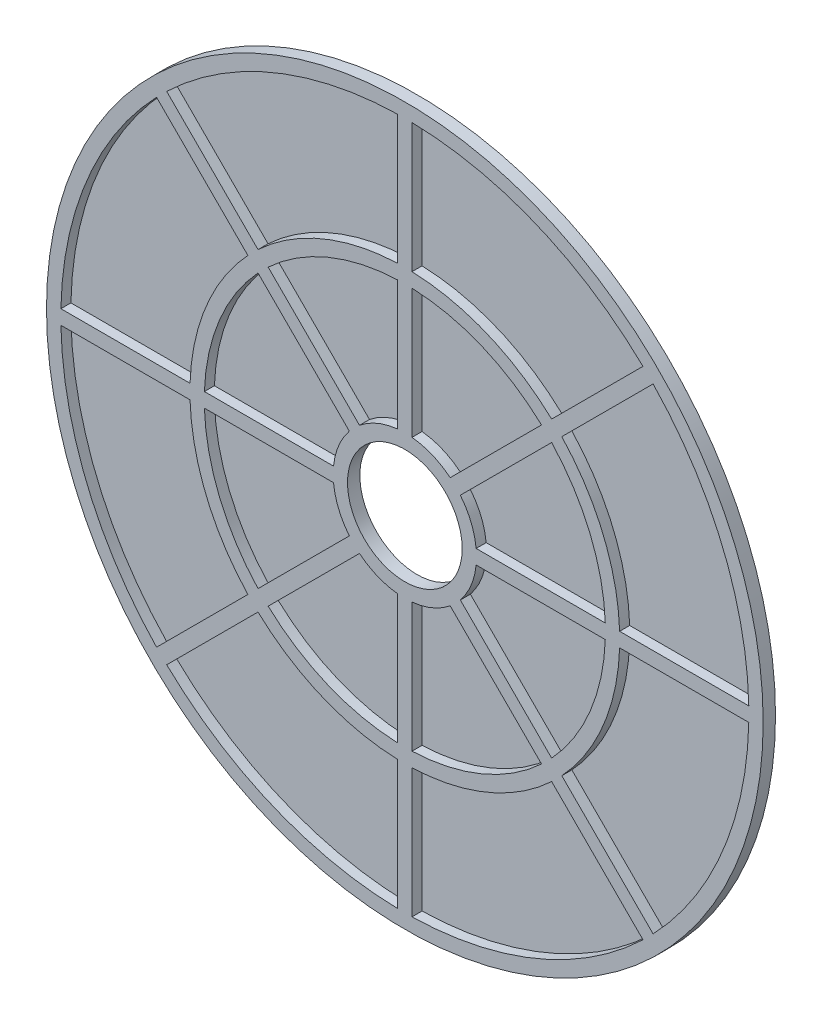
from build123d import *

# Parameters (mm, degrees)
SKETCH1_R           = 250
SKETCH1_R_2         = 40
BOSS_EXTRUDE1_DEPTH = 1.6
SKETCH3_R           = 250
SKETCH3_R_2         = 240
SKETCH3_R_3         = 50
SKETCH3_R_4         = 40
BOSS_EXTRUDE2_DEPTH = 7
RIB2_REACH          = 355.658
SKETCH4_WALLS_W     = 899.315940722
SKETCH4_WALLS_H     = 10
CIRPATTERN1_COUNT   = 8
EXTRUDE_THIN1_START = -7
SKETCH5_R           = 149.934912721
SKETCH5_R_2         = 139.934912721
EXTRUDE_THIN1_DEPTH = 7


with BuildPart() as part:
    # Sketch1 → Boss-Extrude1 (new body)
    with BuildSketch(Plane.XY):
        Circle(SKETCH1_R)
        Circle(SKETCH1_R_2, mode=Mode.SUBTRACT)
    extrude(amount=BOSS_EXTRUDE1_DEPTH)

    # Sketch3 → Boss-Extrude2 (add)
    # profile 1 of 2: a face of its own
    with BuildSketch(Plane.XY.offset(1.6)):
        Circle(SKETCH3_R)
        Circle(SKETCH3_R_2, mode=Mode.SUBTRACT)
    # profile 2 of 2: a face of its own
    with BuildSketch(Plane.XY.offset(1.6)):
        Circle(SKETCH3_R_3)
        Circle(SKETCH3_R_4, mode=Mode.SUBTRACT)
    extrude(amount=BOSS_EXTRUDE2_DEPTH)

    # Sketch4 walls → Rib2 (add, up to next)
    with BuildSketch(Plane.XY.offset(8.6), mode=Mode.PRIVATE) as rib2_sk1:
        with Locations((145, 0)):
            Rectangle(SKETCH4_WALLS_W, SKETCH4_WALLS_H)
    rib2_tool1 = extrude(rib2_sk1.sketch, amount=-RIB2_REACH, mode=Mode.PRIVATE) - part.part
    rib2 = rib2_tool1.solids().sort_by_distance((145, 0, 8.6))[0]
    add(rib2)

    # CirPattern1: Rib2 ×8 about axis
    cirpattern1_axis = Axis((0, 0, 0), (0, 0, 1))
    for i in range(1, CIRPATTERN1_COUNT):
        add(rib2.rotate(cirpattern1_axis, i * 360 / CIRPATTERN1_COUNT))

    # Sketch5 → Extrude-Thin1 (add)
    with BuildSketch(Plane.XY.offset(8.6).offset(EXTRUDE_THIN1_START)):
        Circle(SKETCH5_R)
        Circle(SKETCH5_R_2, mode=Mode.SUBTRACT)
    extrude(amount=EXTRUDE_THIN1_DEPTH)


solid = part.part
